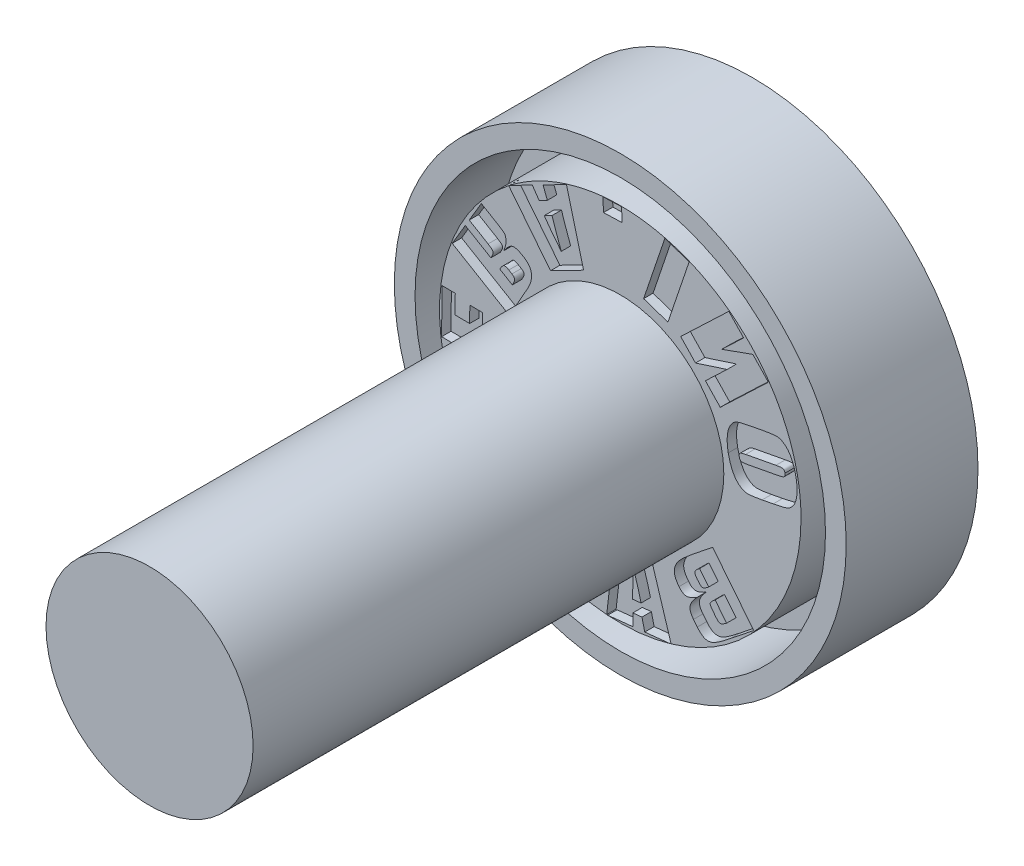
from build123d import *

# Parameters (mm, degrees)
CROQUIS1_R              = 12
SALIENTE_EXTRUIR1_DEPTH = 7
CROQUIS2_R              = 10.9
CROQUIS2_R_2            = 9.6
CORTAR_EXTRUIR1_DEPTH   = 4.5
CROQUIS3_R              = 5.5
SALIENTE_EXTRUIR2_DEPTH = 25
CORTAR_EXTRUIR2_DEPTH   = 0.5


with BuildPart() as part:
    # Croquis1 → Saliente-Extruir1 (new body)
    with BuildSketch(Plane.XY):
        Circle(CROQUIS1_R)
    extrude(amount=SALIENTE_EXTRUIR1_DEPTH)

    # Croquis2 → Cortar-Extruir1 (cut)
    with BuildSketch(Plane.XY.offset(7)):
        Circle(CROQUIS2_R)
        Circle(CROQUIS2_R_2, mode=Mode.SUBTRACT)
    extrude(amount=-CORTAR_EXTRUIR1_DEPTH, mode=Mode.SUBTRACT)

    # Croquis3 → Saliente-Extruir2 (add)
    with BuildSketch(Plane.XY.offset(7)):
        Circle(CROQUIS3_R)
    extrude(amount=SALIENTE_EXTRUIR2_DEPTH)

    # Croquis5 → Cortar-Extruir2 (cut)
    # profile 1 of 11: a face of its own
    with BuildSketch(Plane.XY.offset(7)):
        with BuildLine():
            add(Edge.make_bspline(
                [(8.12287249, -0.060261496), (8.164697474, -0.052351504), (8.245255597, -0.037116251), (8.360919706, -0.013454829), (8.466839757, 0.009874545), (8.563033878, 0.031851046), (8.649526598, 0.053415153), (8.725980376, 0.074868085), (8.793033221, 0.094803006), (8.851792209, 0.114915081), (8.904877869, 0.136944058), (8.954340213, 0.163580483), (9.00132478, 0.194884291), (9.046944781, 0.2300022), (9.089314186, 0.27097539), (9.131000123, 0.315374295), (9.168945291, 0.365735094), (9.20595399, 0.419609768), (9.240016553, 0.47774323), (9.270376579, 0.540159504), (9.29723158, 0.606318638), (9.321729623, 0.675890129), (9.341738511, 0.749582073), (9.358856279, 0.826733248), (9.372429756, 0.907686895), (9.386239517, 1.022023666), (9.393917623, 1.172932319), (9.389364008, 1.363027459), (9.369622233, 1.564427481), (9.346237115, 1.701524102), (9.33418763, 1.772164912)],
                knots=[0, 0, 0, 0, 1.36802112, 2.6349135, 3.794106776, 4.853695163, 5.80608521, 6.65858659, 7.405558504, 8.054041308, 8.653848599, 9.250598769, 9.85619953, 10.466877974, 11.097872632, 11.748330404, 12.422106862, 13.121790568, 13.848419956, 14.585145734, 15.350463312, 16.142173078, 16.954116104, 17.802903593, 18.68117887, 19.591017046, 21.503115681, 23.531202548, 25.697394233, 28, 28, 28, 28], degree=3))
            add(Edge.make_bspline(
                [(9.33418763, 1.772164912), (9.320265779, 1.839182173), (9.293142367, 1.969749346), (9.240422177, 2.158040441), (9.177260172, 2.333294124), (9.116805413, 2.470387139), (9.064472808, 2.572840046), (9.023165413, 2.644048437), (8.979359885, 2.710445713), (8.934300723, 2.77296456), (8.886303505, 2.830252652), (8.837186032, 2.883636852), (8.785287703, 2.931929978), (8.73164541, 2.975329768), (8.676914837, 3.013886377), (8.621967351, 3.047579538), (8.567322435, 3.076739303), (8.511890231, 3.099104666), (8.457151475, 3.118283768), (8.401576335, 3.129690074), (8.346260021, 3.137528345), (8.28921697, 3.139570312), (8.227377823, 3.136661701), (8.157736263, 3.130821758), (8.078120539, 3.123413581), (7.989098421, 3.110775698), (7.88980415, 3.096973322), (7.780992556, 3.078796319), (7.662064421, 3.059309186), (7.579914789, 3.043689705), (7.537188531, 3.035565968)],
                knots=[0, 0, 0, 0, 2.199369402, 4.284947572, 6.277809317, 8.181614776, 9.095809663, 9.974066891, 10.825658681, 11.651478995, 12.44920988, 13.226124443, 13.981460715, 14.725230589, 15.442103757, 16.13134116, 16.795946165, 17.429594913, 18.050865112, 18.656845521, 19.249309117, 19.844851713, 20.487914273, 21.237885649, 22.090898734, 23.057110261, 24.127027847, 25.312696489, 26.602325791, 28, 28, 28, 28], degree=3))
            Line((7.537188531, 3.035565968), (6.946954024, 2.923656325))
            add(Edge.make_bspline(
                [(6.946954024, 2.923656325), (6.905129574, 2.915744185), (6.824572479, 2.900504797), (6.7089013, 2.876871825), (6.603211862, 2.853493326), (6.506940189, 2.831826578), (6.420562153, 2.809735877), (6.343576381, 2.789333703), (6.276569543, 2.769143341), (6.217993941, 2.74916707), (6.165119506, 2.727183797), (6.115853519, 2.700643867), (6.068840545, 2.669368334), (6.023171389, 2.634018232), (5.980393486, 2.593447353), (5.939123658, 2.548410957), (5.90065512, 2.498492151), (5.86365509, 2.444561016), (5.830006561, 2.386029584), (5.799807313, 2.323588573), (5.772035411, 2.257779778), (5.748558002, 2.187836759), (5.728219442, 2.114283422), (5.710595851, 2.037106107), (5.697188063, 1.956300142), (5.683342566, 1.841973534), (5.675572555, 1.690853503), (5.680621407, 1.500788117), (5.699746776, 1.299376299), (5.723662791, 1.162615248), (5.736000233, 1.092064966)],
                knots=[0, 0, 0, 0, 1.368157511, 2.635176197, 3.794485044, 4.847363958, 5.806683843, 6.660022265, 7.407068651, 8.055616108, 8.648591838, 9.245401503, 9.851062642, 10.46180197, 11.099264856, 11.743585767, 12.423361824, 13.123115287, 13.844402589, 14.590939958, 15.351382399, 16.138687564, 16.960367752, 17.803539185, 18.681902024, 19.59183091, 21.504120179, 23.538876434, 25.698661103, 28, 28, 28, 28], degree=3))
            add(Edge.make_bspline(
                [(5.736000233, 1.092064966), (5.749549545, 1.024921097), (5.775936382, 0.894160635), (5.830455443, 0.706369904), (5.891297034, 0.53057684), (5.951701559, 0.393568804), (6.00496921, 0.291813385), (6.04637545, 0.220725637), (6.089083997, 0.153573179), (6.135239302, 0.091828785), (6.182990873, 0.034295501), (6.232187009, -0.019027453), (6.28404109, -0.067369022), (6.337921516, -0.110751054), (6.392475169, -0.149852114), (6.447422956, -0.183631781), (6.502519042, -0.212203653), (6.557986395, -0.234851325), (6.612904181, -0.253822525), (6.668328273, -0.266031351), (6.723571659, -0.273008376), (6.780561632, -0.275776147), (6.842260055, -0.272376638), (6.912012461, -0.267953113), (6.991521065, -0.258860253), (7.080719258, -0.247754475), (7.18000883, -0.233464228), (7.288838082, -0.215436297), (7.407760922, -0.195904472), (7.489911325, -0.180291494), (7.532637984, -0.17217114)],
                knots=[0, 0, 0, 0, 2.200378352, 4.285163969, 6.278408982, 8.175238649, 9.090091896, 9.968307961, 10.818492107, 11.646026269, 12.443719766, 13.220597916, 13.975898787, 14.719633802, 15.442248175, 16.131453274, 16.790824837, 17.434189583, 18.055430664, 18.655672518, 19.254131176, 19.843351153, 20.486383573, 21.238375506, 22.089481019, 23.057341926, 24.127209366, 25.312822438, 26.602391297, 28, 28, 28, 28], degree=3))
            Line((7.532637984, -0.17217114), (8.12287249, -0.060261496))
        make_face()
        with BuildLine():
            add(Edge.make_bspline(
                [(6.735418577, 1.063592608), (6.716279724, 1.059976744), (6.679809774, 1.053086551), (6.627248135, 1.046018971), (6.580073111, 1.039193308), (6.537819387, 1.035522855), (6.500791728, 1.034708636), (6.46902787, 1.035733089), (6.442449174, 1.039144981), (6.413874527, 1.045551523), (6.383244714, 1.063155775), (6.354979311, 1.096715802), (6.334400672, 1.14242216), (6.326243499, 1.177058995), (6.32178621, 1.195985452)],
                knots=[0, 0, 0, 0, 1.383799192, 2.636891922, 3.767923443, 4.77074045, 5.648316987, 6.398787468, 7.026398641, 7.550787666, 8.47187875, 9.474464133, 10.619982262, 12, 12, 12, 12], degree=3))
            add(Edge.make_bspline(
                [(6.32178621, 1.195985452), (6.31915921, 1.212670643), (6.314183454, 1.244273782), (6.316536604, 1.290344317), (6.325899184, 1.331575019), (6.340640259, 1.363164658), (6.360559211, 1.385239951), (6.382485464, 1.401069302), (6.411709381, 1.415524586), (6.447095384, 1.430064834), (6.48959013, 1.444724553), (6.538833528, 1.45857753), (6.595249844, 1.47167766), (6.635173933, 1.479375792), (6.656364586, 1.483461758)],
                knots=[0, 0, 0, 0, 1.1796909, 2.23443268, 3.204716532, 4.129701946, 4.633191944, 5.27041573, 6.009782596, 6.910577969, 7.947327327, 9.154210577, 10.489530008, 12, 12, 12, 12], degree=3))
            Line((6.656364586, 1.483461758), (8.26841774, 1.788205564))
            add(Edge.make_bspline(
                [(8.26841774, 1.788205564), (8.292267887, 1.792693113), (8.3374929, 1.801202471), (8.402145166, 1.811607963), (8.45998126, 1.819102423), (8.510848486, 1.825206385), (8.554698444, 1.827969073), (8.591464503, 1.82885104), (8.621362722, 1.827332088), (8.651928789, 1.821158107), (8.68446929, 1.804713289), (8.713861591, 1.769540339), (8.73608574, 1.721930056), (8.744442948, 1.685064543), (8.74898771, 1.665016579)],
                knots=[0, 0, 0, 0, 1.512281324, 2.867610993, 4.079854702, 5.146481556, 6.059364651, 6.816420041, 7.438106525, 7.919959421, 8.75348244, 9.649780638, 10.721918949, 12, 12, 12, 12], degree=3))
            add(Edge.make_bspline(
                [(8.74898771, 1.665016579), (8.75193516, 1.644018598), (8.757338708, 1.605523088), (8.753190392, 1.550764816), (8.733749923, 1.506019486), (8.706380748, 1.477449089), (8.676994172, 1.459913463), (8.647536418, 1.446510982), (8.610868941, 1.43289648), (8.567122628, 1.419194093), (8.51626551, 1.405458926), (8.458108373, 1.391546182), (8.392659768, 1.377350117), (8.346458199, 1.368514789), (8.322247152, 1.363884804)],
                knots=[0, 0, 0, 0, 1.26419321, 2.317640028, 3.231857968, 4.119616012, 4.626807439, 5.267976279, 6.048902962, 6.959979097, 8.003188549, 9.192520122, 10.528794003, 12, 12, 12, 12], degree=3))
            Line((8.322247152, 1.363884804), (6.735418577, 1.063592608))
        make_face(mode=Mode.SUBTRACT)
    # profile 2 of 11: a face of its own
    with BuildSketch(Plane.XY.offset(7)):
        Polygon((5.310117844, 2.975393344), (7.866484384, 5.408989407), (7.041300536, 6.27565157), (5.389779165, 5.683076097), (6.552241281, 6.78947023), (5.765291098, 7.615888604), (3.208924558, 5.182292542), (3.995874741, 4.355874167), (5.674269693, 4.898380056), (4.523194675, 3.802454534), align=None)
    # profile 3 of 11: a face of its own
    with BuildSketch(Plane.XY.offset(7)):
        Polygon((2.530759542, 5.501960873), (3.659421251, 8.841773424), (2.369407194, 9.277974235), (1.240745485, 5.938161683), align=None)
    # profile 4 of 11: a face of its own
    with BuildSketch(Plane.XY.offset(7)):
        Polygon((0.095123568, 8.864951868), (0.070083714, 9.582213637), (-0.918304128, 9.548403522), (-0.893264274, 8.831141754), align=None)
    # profile 5 of 11: a face of its own
    with BuildSketch(Plane.XY.offset(7)):
        Polygon((-1.946791929, 5.652627183), (-2.856467233, 9.1370703), (-4.100653988, 8.498455822), (-3.872346731, 7.905190956), (-4.309050572, 7.681120719), (-4.669571084, 8.206662414), (-5.928491921, 7.560206443), (-3.705825071, 4.749900107), align=None)
        with BuildLine():
            add(Edge.make_bspline(
                [(-3.622895583, 7.332534226), (-3.607202005, 7.283009662), (-3.574973838, 7.181306538), (-3.524728719, 7.02474771), (-3.469384972, 6.860798127), (-3.409913765, 6.688972861), (-3.346604505, 6.50939534), (-3.280406319, 6.321538747), (-3.209092008, 6.126328116), (-3.159683128, 5.993727184), (-3.134482298, 5.926094533)],
                knots=[0, 0, 0, 0, 0.837360953, 1.71959564, 2.650138511, 3.626327189, 4.650265791, 5.719182105, 6.836676643, 8, 8, 8, 8], degree=3))
            add(Edge.make_bspline(
                [(-3.134482298, 5.926094533), (-3.186501498, 5.990651598), (-3.286869331, 6.115210466), (-3.429501398, 6.296975909), (-3.561381946, 6.464725473), (-3.680097071, 6.620525525), (-3.787294911, 6.763175405), (-3.88268099, 6.892935271), (-3.96511621, 7.010274627), (-4.015442331, 7.084574486), (-4.038938311, 7.119263193)],
                knots=[0, 0, 0, 0, 1.328566641, 2.56338722, 3.702471852, 4.747969182, 5.702177339, 6.561941287, 7.328607114, 8, 8, 8, 8], degree=3))
            Line((-4.038938311, 7.119263193), (-3.622895583, 7.332534226))
        make_face(mode=Mode.SUBTRACT)
    # profile 6 of 11: a face of its own
    with BuildSketch(Plane.XY.offset(7)):
        with BuildLine():
            Line((-5.909405286, 1.611051557), (-5.419298144, 2.436866017))
            add(Edge.make_bspline(
                [(-5.419298144, 2.436866017), (-5.399281786, 2.470767745), (-5.3602231, 2.536921484), (-5.303203856, 2.63429658), (-5.248746412, 2.727406893), (-5.19723544, 2.816815649), (-5.14858555, 2.902257853), (-5.102912009, 2.984008921), (-5.059754413, 3.061475599), (-5.019481644, 3.135072154), (-4.981622308, 3.204129737), (-4.947378253, 3.269832967), (-4.915405212, 3.331259417), (-4.886350754, 3.388964042), (-4.86051135, 3.442740054), (-4.836603252, 3.492311496), (-4.816172318, 3.538081391), (-4.792561984, 3.593191998), (-4.767929784, 3.659152299), (-4.744143337, 3.737273455), (-4.72676482, 3.814661952), (-4.716057097, 3.891230262), (-4.710591831, 3.966888476), (-4.712374953, 4.041816605), (-4.719210001, 4.11566814), (-4.733105346, 4.188669452), (-4.753831434, 4.260874897), (-4.78683217, 4.330422525), (-4.828338858, 4.398424504), (-4.880463544, 4.464155487), (-4.942325557, 4.528129542), (-5.014470001, 4.589703973), (-5.095768415, 4.650538162), (-5.155390541, 4.687055462), (-5.186325797, 4.706002657)],
                knots=[0, 0, 0, 0, 1.437365608, 2.804786524, 4.119755028, 5.375484894, 6.572015023, 7.709390388, 8.794379879, 9.809543755, 10.772358108, 11.669548598, 12.514481156, 13.300628781, 14.028129068, 14.692696648, 15.309814376, 15.857902433, 16.881486059, 17.87861414, 18.837216797, 19.773920987, 20.699034464, 21.603269592, 22.507233483, 23.403672014, 24.313348587, 25.241274218, 26.204629647, 27.216708923, 28.297253747, 29.448664701, 30.676226142, 32, 32, 32, 32], degree=3))
            add(Edge.make_bspline(
                [(-5.186325797, 4.706002657), (-5.214726971, 4.722219032), (-5.269322505, 4.753391745), (-5.350213242, 4.793159559), (-5.426045583, 4.825362438), (-5.497531174, 4.847966459), (-5.564107075, 4.863689438), (-5.626327614, 4.869594561), (-5.683769752, 4.868633087), (-5.737567336, 4.857358382), (-5.789514331, 4.836914871), (-5.841513117, 4.806771161), (-5.895580221, 4.767699209), (-5.951037565, 4.718804843), (-6.008035856, 4.659999723), (-6.066269748, 4.591646127), (-6.126734692, 4.513970192), (-6.165934564, 4.457885966), (-6.186446418, 4.428539148)],
                knots=[0, 0, 0, 0, 1.291210127, 2.482091306, 3.557687686, 4.540967434, 5.439958897, 6.253159344, 7.00341909, 7.699733682, 8.411230522, 9.198893081, 10.066872654, 11.041838152, 12.114429601, 13.298273467, 14.586285632, 16, 16, 16, 16], degree=3))
            add(Edge.make_bspline(
                [(-6.186446418, 4.428539148), (-6.17478779, 4.459156134), (-6.152366371, 4.518037531), (-6.123482481, 4.603788138), (-6.099856021, 4.68308683), (-6.081645611, 4.756028257), (-6.069082803, 4.822771308), (-6.061000218, 4.883054308), (-6.059105017, 4.937189975), (-6.064377803, 4.998649104), (-6.077602414, 5.065238166), (-6.097411256, 5.135350626), (-6.121179846, 5.193783842), (-6.147772093, 5.235132993), (-6.176441116, 5.264617943), (-6.207580507, 5.289478542), (-6.246446507, 5.320529602), (-6.296045358, 5.354201864), (-6.354070625, 5.393571534), (-6.422603865, 5.435977281), (-6.499172933, 5.484739009), (-6.554239377, 5.517196318), (-6.583187429, 5.534258903)],
                knots=[0, 0, 0, 0, 1.434765856, 2.759285916, 3.961896335, 5.057961717, 6.050271554, 6.935092621, 7.719659742, 8.417072261, 9.632090082, 10.686849194, 11.604897707, 12.385914604, 12.821036163, 13.400428935, 14.129507396, 14.999395612, 16.024375055, 17.200728975, 18.528442418, 20, 20, 20, 20], degree=3))
            Line((-6.583187429, 5.534258903), (-7.37815641, 6.005813653))
            Line((-7.37815641, 6.005813653), (-8.02171278, 4.921391603))
            Line((-8.02171278, 4.921391603), (-7.020209472, 4.327170939))
            add(Edge.make_bspline(
                [(-7.020209472, 4.327170939), (-7.000910303, 4.315679987), (-6.964383116, 4.293931271), (-6.914228777, 4.259963615), (-6.870436758, 4.228487237), (-6.833555682, 4.198519306), (-6.803247263, 4.170444103), (-6.780190783, 4.143398002), (-6.762441977, 4.118584505), (-6.752404708, 4.093095978), (-6.748663689, 4.066184768), (-6.75181941, 4.036055297), (-6.758597313, 4.001131989), (-6.771478695, 3.96186889), (-6.788785784, 3.917663588), (-6.812594212, 3.869676793), (-6.840113126, 3.816073713), (-6.8615671, 3.779556439), (-6.872861797, 3.760331492)],
                knots=[0, 0, 0, 0, 1.495374041, 2.830267151, 4.032352353, 5.085392649, 5.993682762, 6.777980554, 7.450563877, 8.014084261, 8.584260982, 9.241817753, 10.021028154, 10.950953858, 11.988089087, 13.180378569, 14.515577216, 16, 16, 16, 16], degree=3))
            Line((-6.872861797, 3.760331492), (-8.232310375, 4.566407272))
            Line((-8.232310375, 4.566407272), (-8.924645935, 3.399389327))
            Line((-8.924645935, 3.399389327), (-5.909405286, 1.611051557))
        make_face()
        with BuildLine():
            Line((-5.733082696, 3.084177772), (-6.403233881, 3.481612129))
            add(Edge.make_bspline(
                [(-6.403233881, 3.481612129), (-6.384600979, 3.511579522), (-6.350312805, 3.566725375), (-6.299334578, 3.640402744), (-6.250574114, 3.695048165), (-6.212926109, 3.731638288), (-6.180349734, 3.749020734), (-6.153423177, 3.754926402), (-6.1230402, 3.755935764), (-6.089241343, 3.75001539), (-6.051922781, 3.739658682), (-6.011331179, 3.723147966), (-5.966764299, 3.701938459), (-5.936576961, 3.684552922), (-5.920570697, 3.67533457)],
                knots=[0, 0, 0, 0, 2.022830878, 3.722403643, 5.1214804, 6.222963719, 6.70288937, 7.216119662, 7.787951051, 8.434764327, 9.173472701, 10.004546597, 10.941948648, 12, 12, 12, 12], degree=3))
            Line((-5.920570697, 3.67533457), (-5.755056059, 3.577219675))
            add(Edge.make_bspline(
                [(-5.755056059, 3.577219675), (-5.733541061, 3.563372906), (-5.694137146, 3.538013068), (-5.647846656, 3.491321634), (-5.618335645, 3.442085971), (-5.610281423, 3.397227102), (-5.613859389, 3.360992228), (-5.618802063, 3.33034777), (-5.629301456, 3.296900385), (-5.642691885, 3.260224807), (-5.660260418, 3.22052739), (-5.680235122, 3.177278629), (-5.705639553, 3.131823857), (-5.723683807, 3.100495884), (-5.733082696, 3.084177772)],
                knots=[0, 0, 0, 0, 1.590115792, 2.912237677, 4.06135296, 5.113815591, 5.680828111, 6.325759852, 7.044024866, 7.860024958, 8.757893505, 9.747412437, 10.826672358, 12, 12, 12, 12], degree=3))
        make_face(mode=Mode.SUBTRACT)
    # profile 7 of 11: a face of its own
    with BuildSketch(Plane.XY.offset(7)):
        Polygon((-5.97162968, -1.205939515), (-5.951794618, 1.067089687), (-6.655198839, 1.073277496), (-6.663249249, 0.163291808), (-7.329964852, 0.168776122), (-7.322270121, 1.020200958), (-7.991558929, 1.025644352), (-7.99925366, 0.174219516), (-8.772154851, 0.180589095), (-8.76360673, 1.180667616), (-9.467654252, 1.186845195), (-9.487987027, -1.176276839), align=None)
    # profile 8 of 11: a face of its own
    with BuildSketch(Plane.XY.offset(7)):
        with BuildLine():
            Line((-4.293710997, -4.326389276), (-4.787281878, -3.498931878))
            add(Edge.make_bspline(
                [(-4.787281878, -3.498931878), (-4.807509831, -3.465087625), (-4.847022726, -3.398976911), (-4.906055231, -3.302419405), (-4.961149571, -3.209138245), (-5.016890941, -3.121687526), (-5.067920585, -3.03736366), (-5.118460432, -2.958407177), (-5.165696256, -2.883309201), (-5.211440567, -2.812747298), (-5.25428813, -2.746050546), (-5.296437108, -2.684786803), (-5.334769789, -2.626753986), (-5.372224192, -2.574049828), (-5.407263877, -2.525414072), (-5.439393955, -2.480682385), (-5.470080411, -2.440945117), (-5.507261722, -2.39370094), (-5.553287276, -2.340167586), (-5.610821407, -2.281669197), (-5.67106214, -2.229961041), (-5.73283363, -2.18296593), (-5.797143176, -2.142549588), (-5.863935988, -2.108214542), (-5.932648916, -2.079223885), (-6.003564308, -2.055865817), (-6.077690621, -2.041076568), (-6.154607667, -2.035605587), (-6.234641003, -2.040202854), (-6.317669358, -2.054358432), (-6.403971542, -2.078594059), (-6.493088119, -2.113196534), (-6.58586554, -2.155765139), (-6.646692094, -2.19084858), (-6.678039946, -2.208929344)],
                knots=[0, 0, 0, 0, 1.434381723, 2.801893688, 4.117197473, 5.375233466, 6.574257674, 7.702639521, 8.785545869, 9.801755542, 10.761909842, 11.66926023, 12.506841312, 13.291903226, 14.021171903, 14.687684439, 15.295290077, 15.847471648, 16.874792, 17.86198498, 18.829245199, 19.760531781, 20.683282101, 21.588449539, 22.48977565, 23.394169397, 24.299908269, 25.232305354, 26.191698583, 27.209225211, 28.29075351, 29.446741524, 30.684140981, 32, 32, 32, 32], degree=3))
            add(Edge.make_bspline(
                [(-6.678039946, -2.208929344), (-6.706252084, -2.226146179), (-6.760181338, -2.259057231), (-6.8339454, -2.312159732), (-6.898945957, -2.363626787), (-6.953454457, -2.416110786), (-6.999501173, -2.467185919), (-7.034659264, -2.51925096), (-7.061677321, -2.570254804), (-7.07780646, -2.623098844), (-7.084800563, -2.678590072), (-7.083456177, -2.738868907), (-7.074829106, -2.805210486), (-7.057818032, -2.877388148), (-7.03363772, -2.955642643), (-7.001917301, -3.040001126), (-6.962348747, -3.130348025), (-6.931705271, -3.191779911), (-6.915790085, -3.223685559)],
                knots=[0, 0, 0, 0, 1.299158063, 2.483421385, 3.571963799, 4.556055438, 5.456163832, 6.270136014, 7.02088449, 7.717176594, 8.429823395, 9.211253728, 10.081800139, 11.056013569, 12.123444132, 13.300750793, 14.598101084, 16, 16, 16, 16], degree=3))
            add(Edge.make_bspline(
                [(-6.915790085, -3.223685559), (-6.937101019, -3.198770121), (-6.978119303, -3.150814059), (-7.040351093, -3.08486966), (-7.098919118, -3.02592951), (-7.154018787, -2.974632498), (-7.207125686, -2.932080952), (-7.256875859, -2.897129102), (-7.303421701, -2.869023579), (-7.360454569, -2.844667133), (-7.425471515, -2.824616525), (-7.496788658, -2.80817238), (-7.559800291, -2.802249212), (-7.609088691, -2.805711826), (-7.648758817, -2.816704616), (-7.685928817, -2.831303922), (-7.731476027, -2.851673144), (-7.785447978, -2.878609477), (-7.847500386, -2.911688782), (-7.918447261, -2.950479106), (-7.997369228, -2.99626042), (-8.052857632, -3.028955284), (-8.082042466, -3.046151566)],
                knots=[0, 0, 0, 0, 1.430800903, 2.753938233, 3.956235784, 5.05731175, 6.037703452, 6.923588965, 7.710367306, 8.405313078, 9.624328603, 10.676077357, 11.594212096, 12.378257301, 12.815300694, 13.385903845, 14.119848382, 14.99253069, 16.018001078, 17.188954467, 18.521494705, 20, 20, 20, 20], degree=3))
            Line((-8.082042466, -3.046151566), (-8.881354516, -3.522720891))
            Line((-8.881354516, -3.522720891), (-8.233766147, -4.60841018))
            Line((-8.233766147, -4.60841018), (-7.226631284, -4.007685321))
            add(Edge.make_bspline(
                [(-7.226631284, -4.007685321), (-7.20730959, -3.996269942), (-7.170572167, -3.974565242), (-7.116547087, -3.946694981), (-7.06771463, -3.923251885), (-7.023624046, -3.904769783), (-6.983940908, -3.892490529), (-6.94920038, -3.884321107), (-6.91887538, -3.881775234), (-6.89171495, -3.883984329), (-6.866487776, -3.89457272), (-6.840328296, -3.910070494), (-6.813086873, -3.933369493), (-6.7850669, -3.963705826), (-6.754322934, -3.999944196), (-6.722702395, -4.043606471), (-6.68903118, -4.093853563), (-6.667016652, -4.130142078), (-6.655453093, -4.149203325)],
                knots=[0, 0, 0, 0, 1.489384023, 2.831849466, 4.033396911, 5.08510626, 6.001182426, 6.788662697, 7.448130851, 8.016490356, 8.576226967, 9.245910586, 10.03042579, 10.944287069, 11.985830995, 13.182985198, 14.520308236, 16, 16, 16, 16], degree=3))
            Line((-6.655453093, -4.149203325), (-8.021942886, -4.964236139))
            Line((-8.021942886, -4.964236139), (-7.324178081, -6.133185148))
            Line((-7.324178081, -6.133185148), (-4.293710997, -4.326389276))
        make_face()
        with BuildLine():
            Line((-5.509987347, -3.466565149), (-6.183559981, -3.868327145))
            add(Edge.make_bspline(
                [(-6.183559981, -3.868327145), (-6.201087445, -3.837579967), (-6.23344142, -3.780823702), (-6.273319285, -3.700328279), (-6.298798043, -3.631357381), (-6.312823892, -3.58078804), (-6.312963914, -3.543618345), (-6.30463611, -3.517064148), (-6.29077477, -3.489902054), (-6.269537653, -3.462813744), (-6.242593344, -3.434670502), (-6.208743545, -3.406214109), (-6.168086452, -3.377618977), (-6.13842656, -3.35915865), (-6.122773794, -3.349416363)],
                knots=[0, 0, 0, 0, 2.019456887, 3.727718701, 5.114687385, 6.216205392, 6.697754742, 7.211346497, 7.786536367, 8.430258044, 9.166413232, 10.007095896, 10.94826113, 12, 12, 12, 12], degree=3))
            Line((-6.122773794, -3.349416363), (-5.955992679, -3.249934932))
            add(Edge.make_bspline(
                [(-5.955992679, -3.249934932), (-5.933409209, -3.237574215), (-5.891904294, -3.214857135), (-5.828389167, -3.195442462), (-5.770425832, -3.194316975), (-5.727433167, -3.209082894), (-5.696823551, -3.229043248), (-5.672629414, -3.248687926), (-5.647673021, -3.273439852), (-5.621798538, -3.302836627), (-5.595232155, -3.336998817), (-5.567138667, -3.375680341), (-5.538728509, -3.419405458), (-5.519788491, -3.450483024), (-5.509987347, -3.466565149)],
                knots=[0, 0, 0, 0, 1.5941812, 2.929857704, 4.078452752, 5.130242861, 5.690308896, 6.339883533, 7.059737751, 7.867712989, 8.767180474, 9.742789941, 10.831931322, 12, 12, 12, 12], degree=3))
        make_face(mode=Mode.SUBTRACT)
    # profile 9 of 11: a face of its own
    with BuildSketch(Plane.XY.offset(7)):
        with BuildLine():
            Line((-1.25999178, -5.969112583), (-2.123386837, -5.543805034))
            add(Edge.make_bspline(
                [(-2.123386837, -5.543805034), (-2.158537168, -5.526390054), (-2.227462462, -5.49224151), (-2.329250936, -5.443205802), (-2.426735265, -5.39628616), (-2.520005337, -5.351886639), (-2.608982253, -5.309607244), (-2.694142292, -5.270463168), (-2.775111639, -5.233913029), (-2.851283038, -5.198341634), (-2.923926672, -5.167292064), (-2.992086104, -5.137925085), (-3.055773511, -5.110472456), (-3.115602858, -5.086105893), (-3.17145156, -5.06460758), (-3.22256669, -5.044810774), (-3.269927218, -5.027922257), (-3.326949628, -5.008910962), (-3.39484687, -4.988843964), (-3.474883454, -4.971390755), (-3.553585576, -4.959762824), (-3.630909287, -4.955245857), (-3.706990884, -4.956170302), (-3.781528778, -4.963019879), (-3.854723298, -4.976849746), (-3.926755149, -4.995667256), (-3.996912839, -5.023250465), (-4.064602568, -5.060329044), (-4.129120203, -5.107630088), (-4.190604755, -5.165196468), (-4.25000036, -5.231879265), (-4.306331719, -5.308695435), (-4.35958999, -5.395480693), (-4.391784353, -5.457672308), (-4.408466178, -5.489897505)],
                knots=[0, 0, 0, 0, 1.429036307, 2.802157021, 4.115894988, 5.370261279, 6.565268614, 7.70455382, 8.78454136, 9.801570428, 10.766807388, 11.662236757, 12.505318163, 13.293198462, 14.015395659, 14.685375256, 15.289987477, 15.846883815, 16.875074603, 17.867407369, 18.828715691, 19.770199772, 20.685850628, 21.598463383, 22.492937918, 23.396814121, 24.306848255, 25.23168553, 26.200740727, 27.212926987, 28.294693354, 29.449410964, 30.678387224, 32, 32, 32, 32], degree=3))
            add(Edge.make_bspline(
                [(-4.408466178, -5.489897505), (-4.422738966, -5.519552902), (-4.450030942, -5.576259024), (-4.483211152, -5.660563322), (-4.508918345, -5.739135912), (-4.5275343, -5.812426992), (-4.537232786, -5.880410315), (-4.538740811, -5.943089022), (-4.532882841, -6.000418215), (-4.51849779, -6.053669555), (-4.4933551, -6.103711906), (-4.4604859, -6.154137128), (-4.416827292, -6.204988642), (-4.363082475, -6.256008431), (-4.300725718, -6.309148537), (-4.227708089, -6.361939983), (-4.145606052, -6.416502292), (-4.086481687, -6.451349118), (-4.055700548, -6.469490962)],
                knots=[0, 0, 0, 0, 1.295213039, 2.476665781, 3.563244948, 4.548150798, 5.449591424, 6.260456959, 7.010453382, 7.711223001, 8.418220006, 9.205583646, 10.076174263, 11.049249529, 12.120635657, 13.298856459, 14.593739283, 16, 16, 16, 16], degree=3))
            add(Edge.make_bspline(
                [(-4.055700548, -6.469490962), (-4.087158981, -6.460139882), (-4.147580909, -6.442179346), (-4.235643749, -6.420916518), (-4.316603257, -6.402882715), (-4.390859914, -6.389815783), (-4.458674359, -6.383289443), (-4.519542509, -6.381032601), (-4.573769814, -6.382798808), (-4.634723056, -6.393305019), (-4.700418239, -6.410794203), (-4.768763081, -6.436587356), (-4.824930614, -6.465539161), (-4.864379009, -6.495294403), (-4.891305838, -6.526666949), (-4.914799968, -6.558861676), (-4.941709921, -6.600914192), (-4.972085694, -6.652748345), (-5.006523203, -6.714075891), (-5.044048164, -6.785337792), (-5.086177111, -6.866054337), (-5.114728256, -6.923531112), (-5.129791536, -6.953855247)],
                knots=[0, 0, 0, 0, 1.433656069, 2.753610323, 3.956966247, 5.057544339, 6.045323656, 6.930736224, 7.718326515, 8.410065929, 9.628179056, 10.683636812, 11.595574397, 12.382718651, 12.821915585, 13.397242836, 14.123350092, 15.00204377, 16.02200842, 17.196078707, 18.520680935, 20, 20, 20, 20], degree=3))
            Line((-5.129791536, -6.953855247), (-5.540099897, -7.787110722))
            Line((-5.540099897, -7.787110722), (-4.407405466, -8.344857692))
            Line((-4.407405466, -8.344857692), (-3.889974416, -7.294940886))
            add(Edge.make_bspline(
                [(-3.889974416, -7.294940886), (-3.879822435, -7.274810548), (-3.860628847, -7.236751629), (-3.831009922, -7.183687535), (-3.8025392, -7.137788325), (-3.775960923, -7.09801423), (-3.749862172, -7.065534236), (-3.724560643, -7.040358049), (-3.700836799, -7.021317474), (-3.676473002, -7.009206107), (-3.649733958, -7.003675082), (-3.619440018, -7.004227339), (-3.584319558, -7.008463287), (-3.544129572, -7.017864602), (-3.49870133, -7.031666442), (-3.448412994, -7.051177334), (-3.393008616, -7.074845446), (-3.354954742, -7.093377999), (-3.335032154, -7.103080465)],
                knots=[0, 0, 0, 0, 1.498788228, 2.833646308, 4.038512036, 5.089067668, 6.012432538, 6.802949269, 7.45881806, 8.026459075, 8.59410009, 9.255678234, 10.032053128, 10.943005424, 11.995494358, 13.186444268, 14.527001213, 16, 16, 16, 16], degree=3))
            Line((-3.335032154, -7.103080465), (-4.03694877, -8.527844822))
            Line((-4.03694877, -8.527844822), (-2.816813766, -9.12881883))
            Line((-2.816813766, -9.12881883), (-1.25999178, -5.969112583))
        make_face()
        with BuildLine():
            Line((-2.746656871, -5.908813469), (-3.092831017, -6.611044131))
            add(Edge.make_bspline(
                [(-3.092831017, -6.611044131), (-3.124246019, -6.595115849), (-3.182308856, -6.565676372), (-3.258614196, -6.519261914), (-3.317891472, -6.476225735), (-3.356409431, -6.440803166), (-3.376947467, -6.409663789), (-3.383874578, -6.382641143), (-3.38758276, -6.352428302), (-3.384837944, -6.318147356), (-3.37663976, -6.280038807), (-3.363493323, -6.238113679), (-3.345929136, -6.191735604), (-3.330870731, -6.160360046), (-3.322897684, -6.143747477)],
                knots=[0, 0, 0, 0, 2.014723796, 3.723716973, 5.102370566, 6.204269213, 6.697511317, 7.21020927, 7.782568788, 8.434720577, 9.165369636, 10.00976397, 10.946220082, 12, 12, 12, 12], degree=3))
            Line((-3.322897684, -6.143747477), (-3.237464918, -5.969649078))
            add(Edge.make_bspline(
                [(-3.237464918, -5.969649078), (-3.225502005, -5.947063578), (-3.203491053, -5.905507781), (-3.160193224, -5.855715975), (-3.11278683, -5.82263205), (-3.058307273, -5.808916672), (-2.996858545, -5.814441444), (-2.924817568, -5.832988238), (-2.839255595, -5.864503615), (-2.779293776, -5.893196229), (-2.746656871, -5.908813469)],
                knots=[0, 0, 0, 0, 1.057253994, 1.94527606, 2.712174681, 3.417696467, 4.225305953, 5.243671314, 6.499744691, 8, 8, 8, 8], degree=3))
        make_face(mode=Mode.SUBTRACT)
    # profile 10 of 11: a face of its own
    with BuildSketch(Plane.XY.offset(7)):
        Polygon((-0.314946434, -6.01731331), (-0.72040721, -9.582272261), (0.665995641, -9.4354092), (0.666918844, -8.802309542), (1.152571237, -8.750523519), (1.299586218, -9.367805635), (2.701987482, -9.218840295), (1.643930403, -5.809325305), align=None)
        with BuildLine():
            add(Edge.make_bspline(
                [(0.63997506, -8.180426927), (0.643348225, -8.128865463), (0.650287288, -8.022796468), (0.658306765, -7.859267234), (0.666578908, -7.687025435), (0.673150682, -7.506177587), (0.678596534, -7.316555354), (0.683728864, -7.118381344), (0.687421817, -6.911370139), (0.689448057, -6.770507487), (0.690482909, -6.698565375)],
                knots=[0, 0, 0, 0, 0.836267299, 1.720316401, 2.649758765, 3.627124147, 4.649115624, 5.719968283, 6.835530252, 8, 8, 8, 8], degree=3))
            add(Edge.make_bspline(
                [(0.690482909, -6.698565375), (0.715531152, -6.777193493), (0.763782545, -6.928657859), (0.831553456, -7.148435743), (0.893893341, -7.351495148), (0.948050769, -7.539120483), (0.996804987, -7.709815388), (1.038184696, -7.864825813), (1.074473717, -8.003110717), (1.094066164, -8.090640251), (1.10320279, -8.131458258)],
                knots=[0, 0, 0, 0, 1.327788267, 2.557769579, 3.700607197, 4.745493743, 5.699922695, 6.556882446, 7.327025066, 8, 8, 8, 8], degree=3))
            Line((1.10320279, -8.131458258), (0.63997506, -8.180426927))
        make_face(mode=Mode.SUBTRACT)
    # profile 11 of 11: a face of its own
    with BuildSketch(Plane.XY.offset(7)):
        with BuildLine():
            Line((4.907701951, -3.666212279), (3.843136369, -4.514961521))
            add(Edge.make_bspline(
                [(3.843136369, -4.514961521), (3.802555816, -4.547612626), (3.723943388, -4.61086417), (3.611553525, -4.704965125), (3.507333797, -4.793588455), (3.412492006, -4.87844833), (3.32710186, -4.95908377), (3.249911458, -5.03465841), (3.182165818, -5.106203872), (3.122369844, -5.174081549), (3.069510719, -5.239875527), (3.024080694, -5.306707523), (2.98338859, -5.373466973), (2.949544261, -5.441782894), (2.920151713, -5.510359372), (2.897857024, -5.580385511), (2.881035795, -5.651114075), (2.86968582, -5.722801781), (2.865640501, -5.79640928), (2.872806461, -5.872047132), (2.890007899, -5.949431099), (2.916442127, -6.029112175), (2.95287041, -6.110779552), (2.999942704, -6.193900655), (3.055719882, -6.279695226), (3.09887779, -6.335469979), (3.121236415, -6.364364958)],
                knots=[0, 0, 0, 0, 1.632892965, 3.163231419, 4.595373289, 5.921763565, 7.152530742, 8.277221867, 9.308105141, 10.240723984, 11.112849894, 11.951872862, 12.772592426, 13.561863636, 14.340060043, 15.109493356, 15.862566197, 16.617527605, 17.382482635, 18.167071917, 18.991226907, 19.862963966, 20.794855432, 21.789879589, 22.855012748, 24, 24, 24, 24], degree=3))
            add(Edge.make_bspline(
                [(3.121236415, -6.364364958), (3.136950555, -6.383375144), (3.16718058, -6.41994593), (3.214599756, -6.469628097), (3.262942017, -6.510535762), (3.309827571, -6.546298959), (3.358021261, -6.572497353), (3.405318123, -6.593493756), (3.453128328, -6.605595154), (3.501756739, -6.610458185), (3.553067081, -6.608450875), (3.608737944, -6.598677498), (3.670200537, -6.582674556), (3.737324705, -6.559229668), (3.810499788, -6.529961458), (3.889089683, -6.493123747), (3.973433771, -6.449626687), (4.031164306, -6.417342297), (4.061260199, -6.400511905)],
                knots=[0, 0, 0, 0, 1.106319264, 2.128278132, 3.075021882, 3.94536796, 4.767315433, 5.529679567, 6.261065416, 6.968654733, 7.715380539, 8.556801549, 9.499087013, 10.561669245, 11.743854365, 13.033100388, 14.453305619, 16, 16, 16, 16], degree=3))
            add(Edge.make_bspline(
                [(4.061260199, -6.400511905), (4.035325455, -6.428965905), (3.985482372, -6.483650659), (3.917838583, -6.56601254), (3.859308423, -6.644384499), (3.810387704, -6.719440868), (3.769702076, -6.79040168), (3.739721153, -6.858582534), (3.717712751, -6.922741023), (3.705578365, -6.984554287), (3.701922576, -7.045138353), (3.706105281, -7.105932415), (3.718096297, -7.167418973), (3.737315514, -7.23005176), (3.764549803, -7.293291201), (3.799451795, -7.357624685), (3.840917005, -7.423396639), (3.873754244, -7.465637629), (3.890667232, -7.487394067)],
                knots=[0, 0, 0, 0, 1.486992896, 2.857799939, 4.11533381, 5.263369669, 6.31714703, 7.270857837, 8.136406259, 8.93209423, 9.696145134, 10.474567604, 11.279559676, 12.110850096, 13.000716626, 13.93435472, 14.936078869, 16, 16, 16, 16], degree=3))
            Line((3.890667232, -7.487394067), (4.092283444, -7.740567063))
            add(Edge.make_bspline(
                [(4.092283444, -7.740567063), (4.110368612, -7.762741169), (4.145413018, -7.805708883), (4.199697898, -7.864914751), (4.25374047, -7.917187226), (4.306715718, -7.96311411), (4.359626826, -8.00156106), (4.411356068, -8.034020357), (4.463377259, -8.05797983), (4.514486454, -8.076883156), (4.566348631, -8.08849301), (4.619113304, -8.094374027), (4.673290733, -8.095625817), (4.72890291, -8.090767321), (4.785996685, -8.080653435), (4.844548547, -8.064769509), (4.904140896, -8.04310545), (4.967300389, -8.015770551), (5.037141069, -7.979230842), (5.117212235, -7.930864873), (5.209962011, -7.870867252), (5.315025273, -7.798011884), (5.432295612, -7.712732482), (5.562388443, -7.615313587), (5.704482664, -7.505427361), (5.802949941, -7.427445148), (5.854360607, -7.38672992)],
                knots=[0, 0, 0, 0, 0.979648338, 1.898306583, 2.748397566, 3.553161138, 4.296586807, 4.986279647, 5.640212866, 6.254122327, 6.848937208, 7.454711544, 8.069674174, 8.701376776, 9.362853106, 10.052702303, 10.77586813, 11.532273317, 12.407647723, 13.472439794, 14.734328856, 16.189581227, 17.849594289, 19.699094698, 21.75445796, 24, 24, 24, 24], degree=3))
            Line((5.854360607, -7.38672992), (7.088269393, -6.403037929))
            Line((7.088269393, -6.403037929), (4.907701951, -3.666212279))
        make_face()
        with BuildLine():
            Line((4.21376979, -4.98483995), (4.698720606, -5.592963485))
            add(Edge.make_bspline(
                [(4.698720606, -5.592963485), (4.687773353, -5.601475357), (4.6672011, -5.617471004), (4.638056018, -5.639850624), (4.613463411, -5.659887722), (4.598047544, -5.671873755), (4.591066683, -5.677301462)],
                knots=[0, 0, 0, 0, 1.216786307, 2.286604321, 3.224112615, 4, 4, 4, 4], degree=3))
            add(Edge.make_bspline(
                [(4.591066683, -5.677301462), (4.578390792, -5.687033415), (4.554157836, -5.705638337), (4.51835774, -5.730594764), (4.484487445, -5.750604509), (4.453543262, -5.767158004), (4.424086308, -5.777491093), (4.397363385, -5.785350507), (4.372411106, -5.787669299), (4.348683362, -5.785352857), (4.324511556, -5.776690153), (4.298467818, -5.760651329), (4.268624597, -5.738606537), (4.235434036, -5.709476826), (4.198898865, -5.673431061), (4.159571881, -5.629689759), (4.115969713, -5.579581395), (4.086612377, -5.543071466), (4.07109932, -5.523778824)],
                knots=[0, 0, 0, 0, 1.167231682, 2.231438729, 3.184221933, 4.040581567, 4.787854684, 5.460480743, 6.069754811, 6.605992132, 7.188924428, 7.927113326, 8.83208794, 9.897216778, 11.149134202, 12.578652311, 14.192085262, 16, 16, 16, 16], degree=3))
            add(Edge.make_bspline(
                [(4.07109932, -5.523778824), (4.055804453, -5.503686611), (4.027642562, -5.466691537), (3.993702651, -5.41199532), (3.9712538, -5.36296582), (3.961959276, -5.318161178), (3.962444573, -5.278160163), (3.969208523, -5.241433705), (3.983088731, -5.207340713), (4.005179395, -5.174380568), (4.038144875, -5.138578533), (4.083742466, -5.095599864), (4.143731217, -5.042979395), (4.188917595, -5.005469908), (4.21376979, -4.98483995)],
                knots=[0, 0, 0, 0, 1.356334076, 2.49736952, 3.454015822, 4.238056257, 4.934343148, 5.591673699, 6.233980487, 6.897645689, 7.712587853, 8.84415493, 10.264307106, 12, 12, 12, 12], degree=3))
        make_face(mode=Mode.SUBTRACT)
        with BuildLine():
            Line((5.038328201, -6.019474209), (5.64844858, -6.784814358))
            add(Edge.make_bspline(
                [(5.64844858, -6.784814358), (5.629982717, -6.798732336), (5.594903261, -6.825172211), (5.543816969, -6.86106947), (5.496878675, -6.891913528), (5.453966435, -6.917168299), (5.41557899, -6.938185404), (5.381112023, -6.952772407), (5.350981459, -6.962901213), (5.323730571, -6.968332932), (5.297579376, -6.967124699), (5.271680641, -6.960172169), (5.244604555, -6.948422192), (5.216177725, -6.931388109), (5.187459443, -6.907805154), (5.157479878, -6.879562057), (5.125623966, -6.846586966), (5.105395637, -6.821574984), (5.094709578, -6.808361856)],
                knots=[0, 0, 0, 0, 1.671123291, 3.174619806, 4.511935293, 5.728953938, 6.772988994, 7.672120521, 8.429718428, 9.068798319, 9.667706982, 10.303394505, 10.996573972, 11.795536606, 12.689845581, 13.676135467, 14.772367619, 16, 16, 16, 16], degree=3))
            Line((5.094709578, -6.808361856), (4.891497542, -6.553505241))
            add(Edge.make_bspline(
                [(4.891497542, -6.553505241), (4.880464995, -6.539503195), (4.85947395, -6.512862244), (4.832387731, -6.472997556), (4.810128093, -6.436356342), (4.793184949, -6.40279352), (4.780973943, -6.372196249), (4.77490981, -6.344203794), (4.772306893, -6.318812016), (4.77737428, -6.295172705), (4.787920204, -6.271677029), (4.80503838, -6.246453516), (4.827602887, -6.217110144), (4.857180724, -6.18433025), (4.893186087, -6.147980566), (4.935574581, -6.107924707), (4.984310501, -6.064350974), (5.019719188, -6.034934184), (5.038328201, -6.019474209)],
                knots=[0, 0, 0, 0, 1.270901653, 2.418077427, 3.434890772, 4.325907838, 5.097930084, 5.775211096, 6.365579678, 6.901099238, 7.477027271, 8.19308886, 9.069014068, 10.116311936, 11.338709728, 12.717320882, 14.274790133, 16, 16, 16, 16], degree=3))
        make_face(mode=Mode.SUBTRACT)
    extrude(amount=-CORTAR_EXTRUIR2_DEPTH, mode=Mode.SUBTRACT)


solid = part.part
